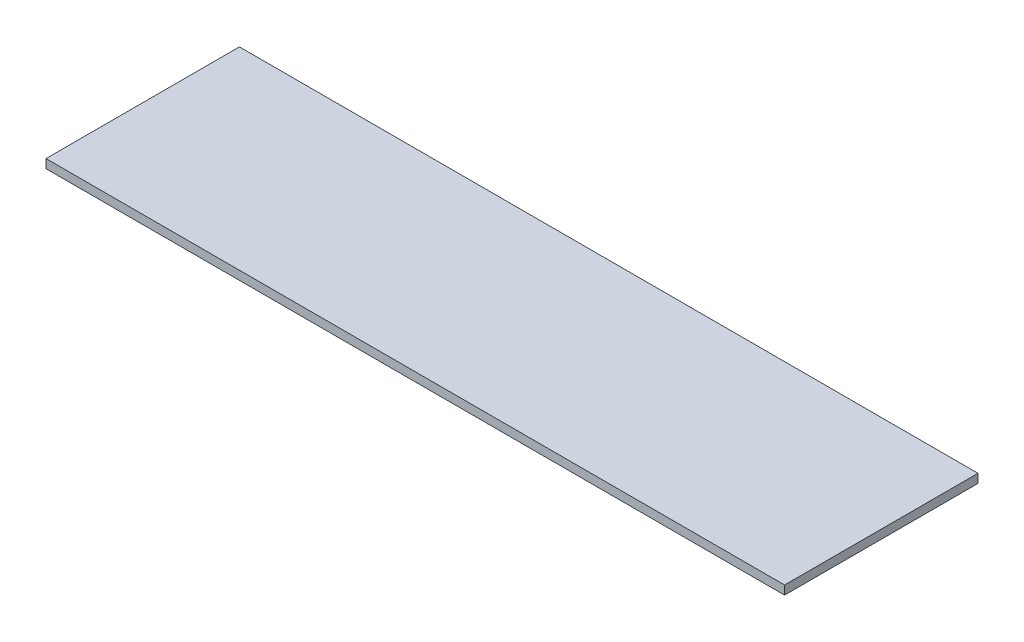
from build123d import *

# Parameters (mm, degrees)
SKETCH1_W           = 133.35
SKETCH1_H           = 34.925
BOSS_EXTRUDE1_DEPTH = 1.5875


with BuildPart() as part:
    # Sketch1 → Boss-Extrude1 (new body)
    with BuildSketch(Plane(origin=(0, 0, 0), x_dir=(1, 0, 0), z_dir=(0, 1, 0))):
        with Locations((66.675, 17.4625)):
            Rectangle(SKETCH1_W, SKETCH1_H)
    extrude(amount=BOSS_EXTRUDE1_DEPTH)


solid = part.part
